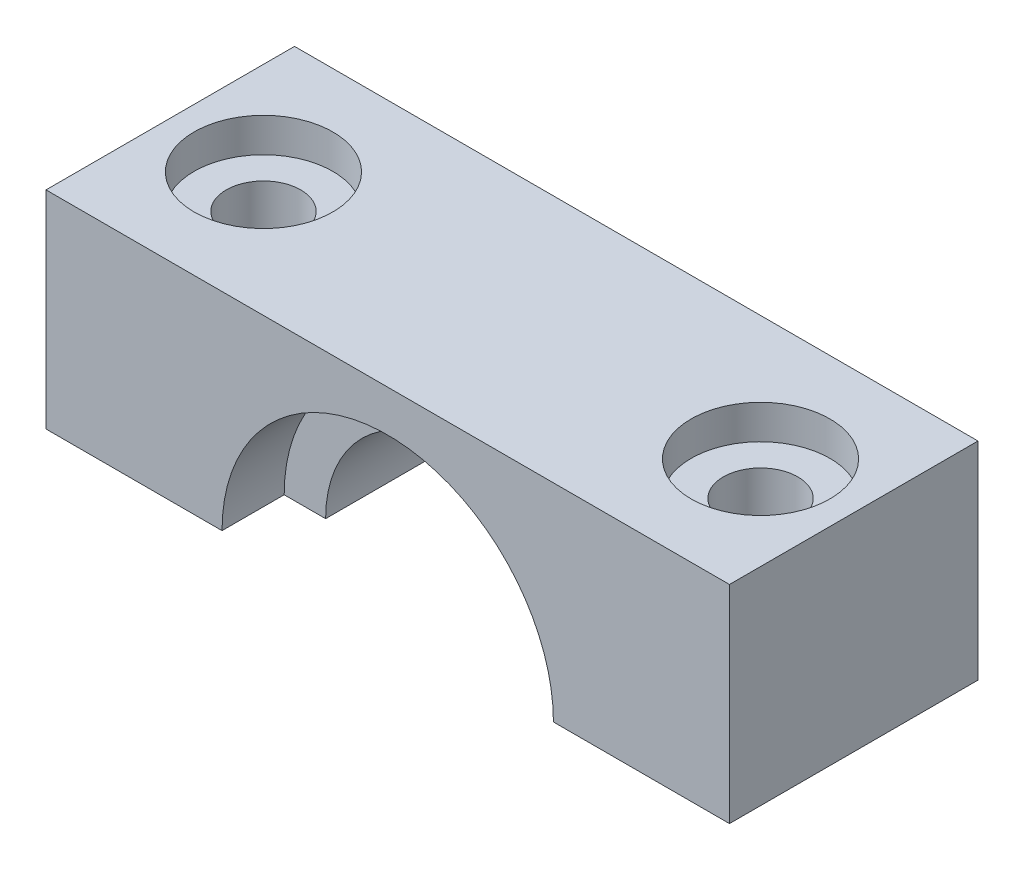
from build123d import *

# Parameters (mm, degrees)
SKETCH1_W                       = 33
SKETCH1_H                       = 12
BOSS_EXTRUDE1_DEPTH             = 10
CBORE_FOR_M3_SBHCS1_D           = 3.6
CBORE_FOR_M3_SBHCS1_CBORE_D     = 6.7
CBORE_FOR_M3_SBHCS1_CBORE_DEPTH = 1.65


with BuildPart() as part:
    # Sketch1 → Boss-Extrude1 (new body)
    with BuildSketch(Plane(origin=(0, 0, 0), x_dir=(1, 0, 0), z_dir=(0, 1, 0))):
        Rectangle(SKETCH1_W, SKETCH1_H)
    extrude(amount=BOSS_EXTRUDE1_DEPTH)

    # Sketch1<4> → Cut-Revolve1 (revolve, cut)
    with BuildSketch(Plane(origin=(0, 0, 0), x_dir=(1, 0, 0), z_dir=(0, 1, 0))):
        Polygon((0, 6), (-8, 6), (-8, 3), (-6, 3), (-6, -3), (-8, -3), (-8, -6), (0, -6), align=None)
    revolve(axis=Axis((0, 0, -6), (0, 0, 1)), mode=Mode.SUBTRACT)

    # CBORE for M3 SBHCS1 (through all)
    with Locations(Plane(origin=(-12, 10, 0), x_dir=(0, 0, 1), z_dir=(0, 1, 0))):
        with Locations((0, 0), (0, 24)):
            CounterBoreHole(CBORE_FOR_M3_SBHCS1_D / 2, CBORE_FOR_M3_SBHCS1_CBORE_D / 2, CBORE_FOR_M3_SBHCS1_CBORE_DEPTH)


solid = part.part
